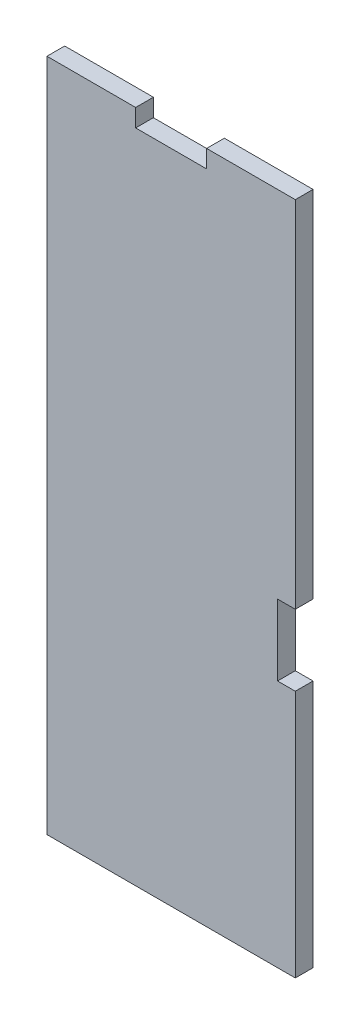
from build123d import *

# Parameters (mm, degrees)
BOSS_EXTRUDE1_DEPTH = 2.5


with BuildPart() as part:
    # Sketch1 → Boss-Extrude1 (new body)
    with BuildSketch(Plane.XY):
        Polygon((-2.837615564, 46.083177434), (-15.337615564, 46.083177434), (-15.337615564, 43.583177434), (-25.337615564, 43.583177434), (-25.337615564, 46.083177434), (-37.837615564, 46.083177434), (-37.837615564, -48.916822566), (-2.837615564, -48.916822566), (-2.837615564, -13.916822566), (-5.337615564, -13.916822566), (-5.337615564, -3.916822566), (-2.837615564, -3.916822566), align=None)
    extrude(amount=BOSS_EXTRUDE1_DEPTH)


solid = part.part
